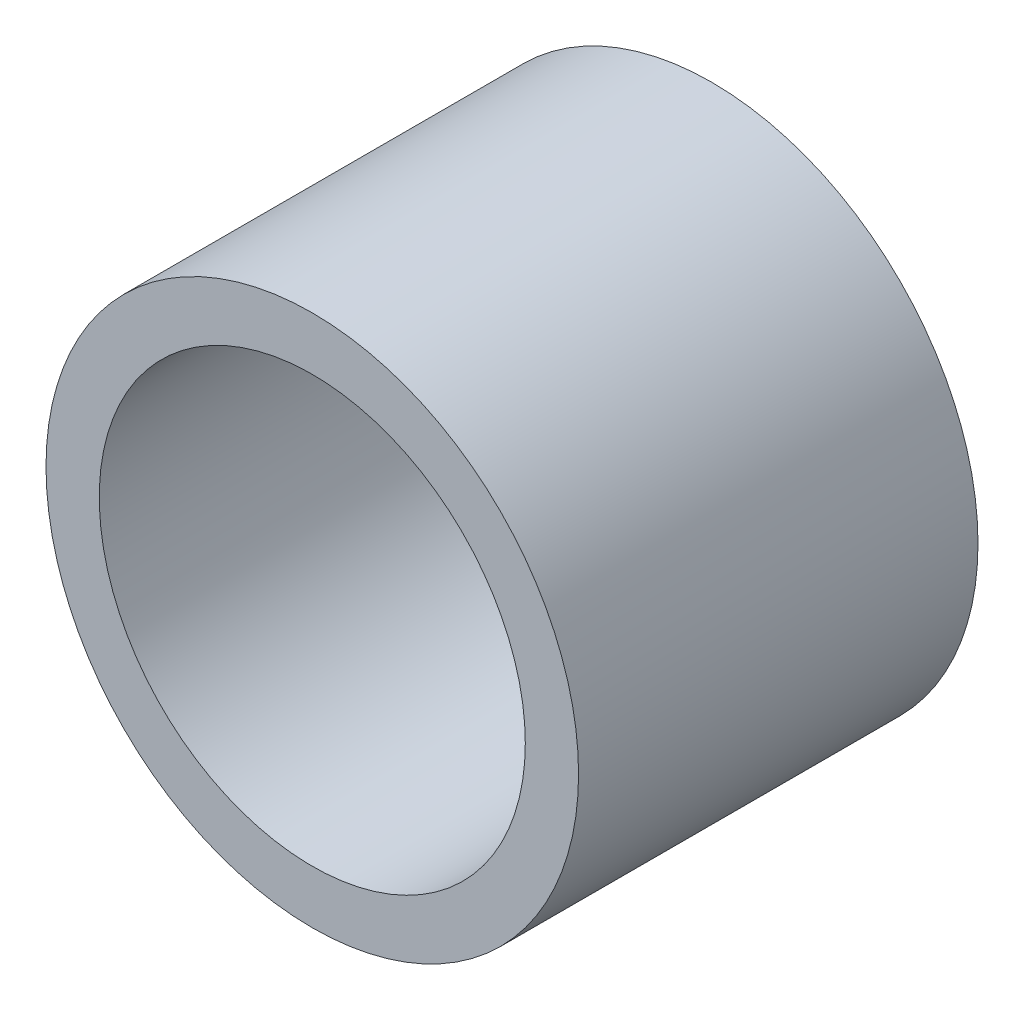
from build123d import *

# Parameters (mm, degrees)
SKETCH1_R           = 2
SKETCH1_R_2         = 1.6
BOSS_EXTRUDE1_DEPTH = 3


with BuildPart() as part:
    # Sketch1 → Boss-Extrude1 (new body)
    with BuildSketch(Plane.XY):
        Circle(SKETCH1_R)
        Circle(SKETCH1_R_2, mode=Mode.SUBTRACT)
    extrude(amount=BOSS_EXTRUDE1_DEPTH)


solid = part.part
